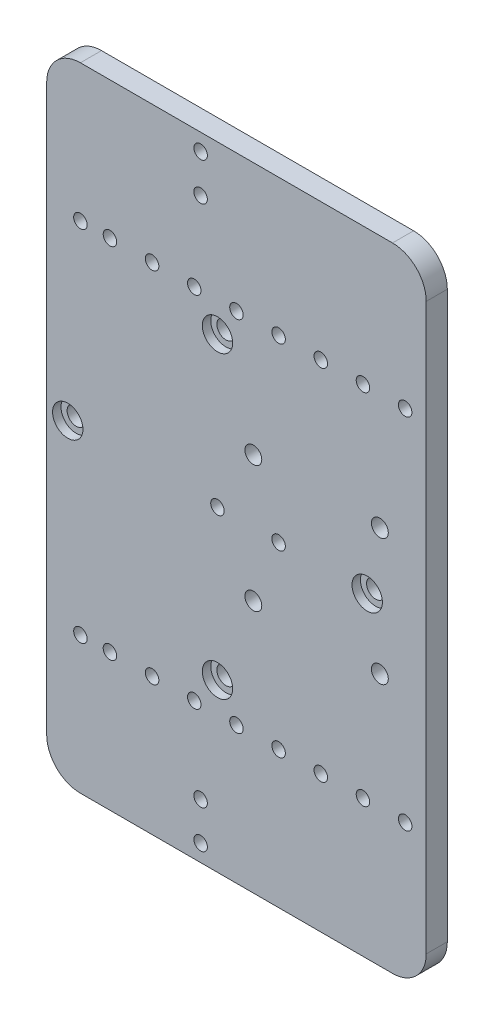
from build123d import *

# Parameters (mm, degrees)
SKETCH_1_W          = 90
SKETCH_1_H          = 150
SKETCH_1_R          = 2
SKETCH_1_R_2        = 2.15
SKETCH_1_R_3        = 1.6
EXTRUDE_1_DEPTH     = 5
FILLET_1_R          = 8
SKETCH_2_R          = 3.6
CUT_EXTRUDE_1_DEPTH = 2
SKETCH_4_R          = 30
EXTRUDE_2_DEPTH     = 4


with BuildPart() as part:
    # 草图1 → 凸台-拉伸1 (new body)
    with BuildSketch(Plane.XY):
        with Locations((45, -75)):
            Rectangle(SKETCH_1_W, SKETCH_1_H)
        with Locations((79, -60)):
            Circle(SKETCH_1_R, mode=Mode.SUBTRACT)
        with Locations((79, -90)):
            Circle(SKETCH_1_R, mode=Mode.SUBTRACT)
        with Locations((49, -60)):
            Circle(SKETCH_1_R, mode=Mode.SUBTRACT)
        with Locations((49, -90)):
            Circle(SKETCH_1_R, mode=Mode.SUBTRACT)
        with Locations((40.5, -39.5)):
            Circle(SKETCH_1_R_2, mode=Mode.SUBTRACT)
        with Locations((40.5, -110.5)):
            Circle(SKETCH_1_R_2, mode=Mode.SUBTRACT)
        with Locations((76, -75)):
            Circle(SKETCH_1_R_2, mode=Mode.SUBTRACT)
        with Locations((5, -75)):
            Circle(SKETCH_1_R_2, mode=Mode.SUBTRACT)
        with Locations((85, -117.5)):
            Circle(SKETCH_1_R_3, mode=Mode.SUBTRACT)
        with Locations((75, -117.5)):
            Circle(SKETCH_1_R_3, mode=Mode.SUBTRACT)
        with Locations((65, -117.5)):
            Circle(SKETCH_1_R_3, mode=Mode.SUBTRACT)
        with Locations((55, -117.5)):
            Circle(SKETCH_1_R_3, mode=Mode.SUBTRACT)
        with Locations((45, -117.5)):
            Circle(SKETCH_1_R_3, mode=Mode.SUBTRACT)
        with Locations((85, -32.5)):
            Circle(SKETCH_1_R_3, mode=Mode.SUBTRACT)
        with Locations((75, -32.5)):
            Circle(SKETCH_1_R_3, mode=Mode.SUBTRACT)
        with Locations((65, -32.5)):
            Circle(SKETCH_1_R_3, mode=Mode.SUBTRACT)
        with Locations((55, -32.5)):
            Circle(SKETCH_1_R_3, mode=Mode.SUBTRACT)
        with Locations((45, -32.5)):
            Circle(SKETCH_1_R_3, mode=Mode.SUBTRACT)
        with Locations((35, -117.5)):
            Circle(SKETCH_1_R_3, mode=Mode.SUBTRACT)
        with Locations((25, -117.5)):
            Circle(SKETCH_1_R_3, mode=Mode.SUBTRACT)
        with Locations((15, -117.5)):
            Circle(SKETCH_1_R_3, mode=Mode.SUBTRACT)
        with Locations((35, -32.5)):
            Circle(SKETCH_1_R_3, mode=Mode.SUBTRACT)
        with Locations((25, -32.5)):
            Circle(SKETCH_1_R_3, mode=Mode.SUBTRACT)
        with Locations((15, -32.5)):
            Circle(SKETCH_1_R_3, mode=Mode.SUBTRACT)
        with Locations((8, -117.5)):
            Circle(SKETCH_1_R_3, mode=Mode.SUBTRACT)
        with Locations((8, -32.5)):
            Circle(SKETCH_1_R_3, mode=Mode.SUBTRACT)
        with Locations((36.5, -4)):
            Circle(SKETCH_1_R_3, mode=Mode.SUBTRACT)
        with Locations((36.5, -13)):
            Circle(SKETCH_1_R_3, mode=Mode.SUBTRACT)
        with Locations((36.5, -137)):
            Circle(SKETCH_1_R_3, mode=Mode.SUBTRACT)
        with Locations((36.5, -146)):
            Circle(SKETCH_1_R_3, mode=Mode.SUBTRACT)
        with Locations((55, -75)):
            Circle(SKETCH_1_R_3, mode=Mode.SUBTRACT)
        with Locations((40.5, -75)):
            Circle(SKETCH_1_R_3, mode=Mode.SUBTRACT)
    extrude(amount=EXTRUDE_1_DEPTH)

    # 圆角1
    fillet_1_edges = [part.edges().sort_by_distance(p)[0] for p in [
        (0, 0, 2.5),
        (90, 0, 2.5),
        (90, -150, 2.5),
        (0, -150, 2.5),
    ]]
    fillet(fillet_1_edges, radius=FILLET_1_R)

    # 草图2 → 切除-拉伸1 (cut)
    with BuildSketch(Plane.XY.offset(5)):
        with Locations((40.5, -39.5)):
            Circle(SKETCH_2_R)
        with Locations((76, -75)):
            Circle(SKETCH_2_R)
        with Locations((5, -75)):
            Circle(SKETCH_2_R)
        with Locations((40.5, -110.5)):
            Circle(SKETCH_2_R)
    extrude(amount=-CUT_EXTRUDE_1_DEPTH, mode=Mode.SUBTRACT)

    # 草图4 → 凸台-拉伸2 (add)
    with BuildSketch(Plane(origin=(0, 0, 0), x_dir=(-1, 0, 0), z_dir=(0, 0, -1))):
        with BuildLine():
            ThreePointArc((-42.199612772, -35.036124857), (-68.784271247, -46.715728753), (-80.463875143, -73.300387228))
            ThreePointArc((-80.463875143, -73.300387228), (-71.223509147, -75), (-80.463875143, -76.699612772))
            ThreePointArc((-80.463875143, -76.699612772), (-68.784271247, -103.284271247), (-42.199612772, -114.963875143))
            ThreePointArc((-42.199612772, -114.963875143), (-40.5, -105.723509147), (-38.800387228, -114.963875143))
            ThreePointArc((-38.800387228, -114.963875143), (-12.215728753, -103.284271247), (-0.536124857, -76.699612772))
            ThreePointArc((-0.536124857, -76.699612772), (-9.776490853, -75), (-0.536124857, -73.300387228))
            ThreePointArc((-0.536124857, -73.300387228), (-12.215728753, -46.715728753), (-38.800387228, -35.036124857))
            ThreePointArc((-38.800387228, -35.036124857), (-40.5, -44.276490853), (-42.199612772, -35.036124857))
        make_face()
        with Locations((-40.5, -75)):
            Circle(SKETCH_4_R, mode=Mode.SUBTRACT)
    extrude(amount=EXTRUDE_2_DEPTH)


solid = part.part
